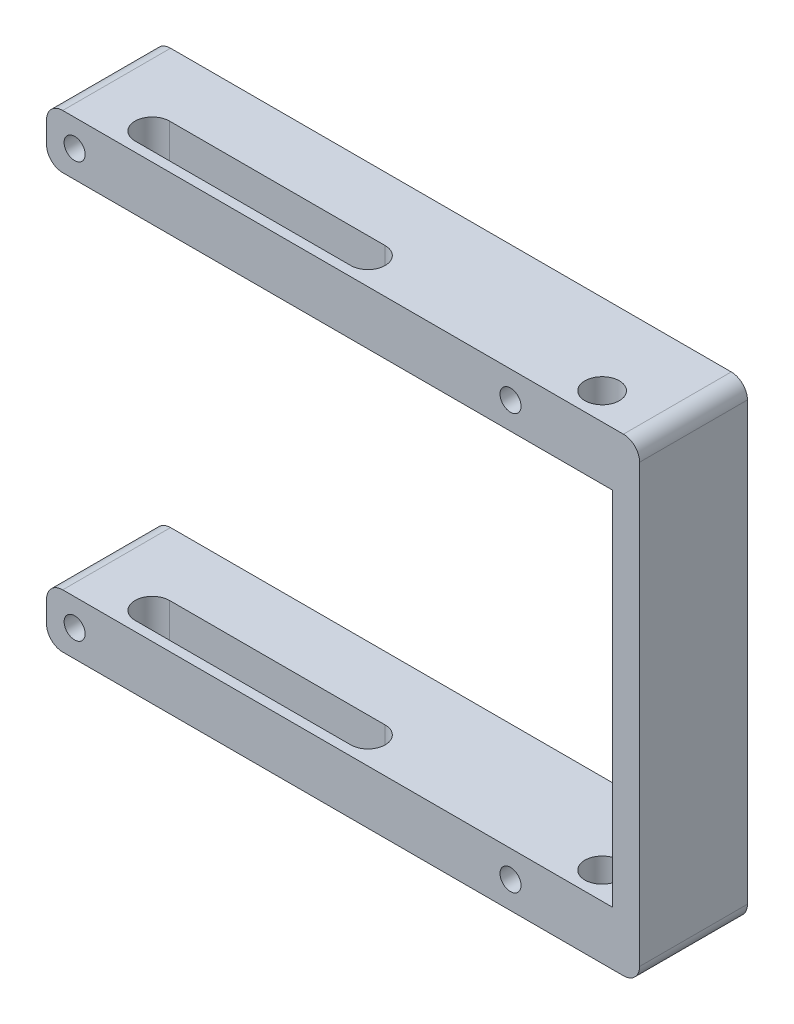
from build123d import *

# Parameters (mm, degrees)
CROQUIS1_W              = 105
CROQUIS1_H              = 10
CROQUIS1_W_2            = 5
CROQUIS1_H_2            = 33.5
SALIENTE_EXTRUIR1_DEPTH = 10
CROQUIS2_R              = 3.2
CORTAR_EXTRUIR1_DEPTH   = 111.759992767
CROQUIS3_R              = 1.95
CORTAR_EXTRUIR2_DEPTH   = 4.9
CROQUIS4_R              = 1.65
CORTAR_EXTRUIR3_DEPTH   = 115.406232338
REDONDEO1_R             = 3
CROQUIS7_R              = 1.65
SALIENTE_EXTRUIR2_DEPTH = 10


with BuildPart() as part:
    # Croquis1 → Saliente-Extruir1 (new body)
    with BuildSketch(Plane.XY):
        with Locations((10.314275766, 87)):
            Rectangle(CROQUIS1_W, CROQUIS1_H)
        with Locations((65.314275766, 87)):
            Rectangle(CROQUIS1_W_2, CROQUIS1_H)
        with Locations((65.314275766, 65.25)):
            Rectangle(CROQUIS1_W_2, CROQUIS1_H_2)
        with Locations((65.314275766, 31.75)):
            Rectangle(CROQUIS1_W_2, CROQUIS1_H_2)
        with Locations((65.314275766, 10)):
            Rectangle(CROQUIS1_W_2, CROQUIS1_H)
        with Locations((10.314275766, 10)):
            Rectangle(CROQUIS1_W, CROQUIS1_H)
    extrude(amount=SALIENTE_EXTRUIR1_DEPTH)

    # Croquis2 → Cortar-Extruir1 (cut, through all)
    with BuildSketch(Plane(origin=(0, 92, 0), x_dir=(1, 0, 0), z_dir=(0, 1, 0))):
        with Locations(Location((55.860494793, -5, 0), (0, 0, 180))):
            Circle(CROQUIS2_R)
        with BuildLine():
            Line((12.425652442, -8.2), (-27.574347558, -8.2))
            ThreePointArc((-27.574347558, -8.2), (-30.774347558, -5), (-27.574347558, -1.8))
            Line((-27.574347558, -1.8), (12.425652442, -1.8))
            ThreePointArc((12.425652442, -1.8), (15.625652442, -5), (12.425652442, -8.2))
        make_face()
    extrude(amount=-CORTAR_EXTRUIR1_DEPTH, mode=Mode.SUBTRACT)

    # Croquis3 → Cortar-Extruir2 (cut)
    with BuildSketch(Plane.XY.offset(10)):
        with Locations((-36.979834841, 87)):
            Circle(CROQUIS3_R)
        with Locations((-36.979834841, 10)):
            Circle(CROQUIS3_R)
        with Locations((43.869300962, 10)):
            Circle(CROQUIS3_R)
        with Locations((43.869300962, 87)):
            Circle(CROQUIS3_R)
    extrude(amount=-CORTAR_EXTRUIR2_DEPTH, mode=Mode.SUBTRACT)

    # Croquis4 → Cortar-Extruir3 (cut, through all)
    with BuildSketch(Plane.XY.offset(5.1)):
        with Locations((-36.979834841, 87)):
            Circle(CROQUIS4_R)
        with Locations((-36.979834841, 10)):
            Circle(CROQUIS4_R)
        with Locations((43.869300962, 10)):
            Circle(CROQUIS4_R)
        with Locations((43.869300962, 87)):
            Circle(CROQUIS4_R)
    extrude(amount=-CORTAR_EXTRUIR3_DEPTH, mode=Mode.SUBTRACT)

    # Redondeo1
    redondeo1_edges = [part.edges().sort_by_distance(p)[0] for p in [
        (-42.185724234, 82, 5),
        (-42.185724234, 92, 5),
        (67.814275766, 92, 5),
        (67.814275766, 5, 5),
        (-42.185724234, 5, 5),
        (-42.185724234, 15, 5),
    ]]
    fillet(redondeo1_edges, radius=REDONDEO1_R)

    # Croquis7 → Saliente-Extruir2 (add)
    with BuildSketch(Plane(origin=(0, 0, 0), x_dir=(-1, 0, 0), z_dir=(0, 0, -1))):
        with BuildLine():
            Line((39.185724234, 92), (-64.814275766, 92))
            ThreePointArc((-64.814275766, 92), (-66.93559611, 91.121320344), (-67.814275766, 89))
            Line((-67.814275766, 89), (-67.814275766, 8))
            ThreePointArc((-67.814275766, 8), (-66.93559611, 5.878679656), (-64.814275766, 5))
            Line((-64.814275766, 5), (39.185724234, 5))
            ThreePointArc((39.185724234, 5), (41.307044577, 5.878679656), (42.185724234, 8))
            Line((42.185724234, 8), (42.185724234, 12))
            ThreePointArc((42.185724234, 12), (41.307044577, 14.121320344), (39.185724234, 15))
            Line((39.185724234, 15), (-62.814275766, 15))
            Line((-62.814275766, 15), (-62.814275766, 82))
            Line((-62.814275766, 82), (39.185724234, 82))
            ThreePointArc((39.185724234, 82), (41.307044577, 82.878679656), (42.185724234, 85))
            Line((42.185724234, 85), (42.185724234, 89))
            ThreePointArc((42.185724234, 89), (41.307044577, 91.121320344), (39.185724234, 92))
        make_face()
        with Locations(Location((36.979834841, 87, 0), (0, 0, 180))):
            Circle(CROQUIS7_R, mode=Mode.SUBTRACT)
        with Locations(Location((36.979834841, 10, 0), (0, 0, 180))):
            Circle(CROQUIS7_R, mode=Mode.SUBTRACT)
        with Locations(Location((-43.869300962, 10, 0), (0, 0, 180))):
            Circle(CROQUIS7_R, mode=Mode.SUBTRACT)
        with Locations(Location((-43.869300962, 87, 0), (0, 0, 180))):
            Circle(CROQUIS7_R, mode=Mode.SUBTRACT)
    extrude(amount=SALIENTE_EXTRUIR2_DEPTH)


solid = part.part
